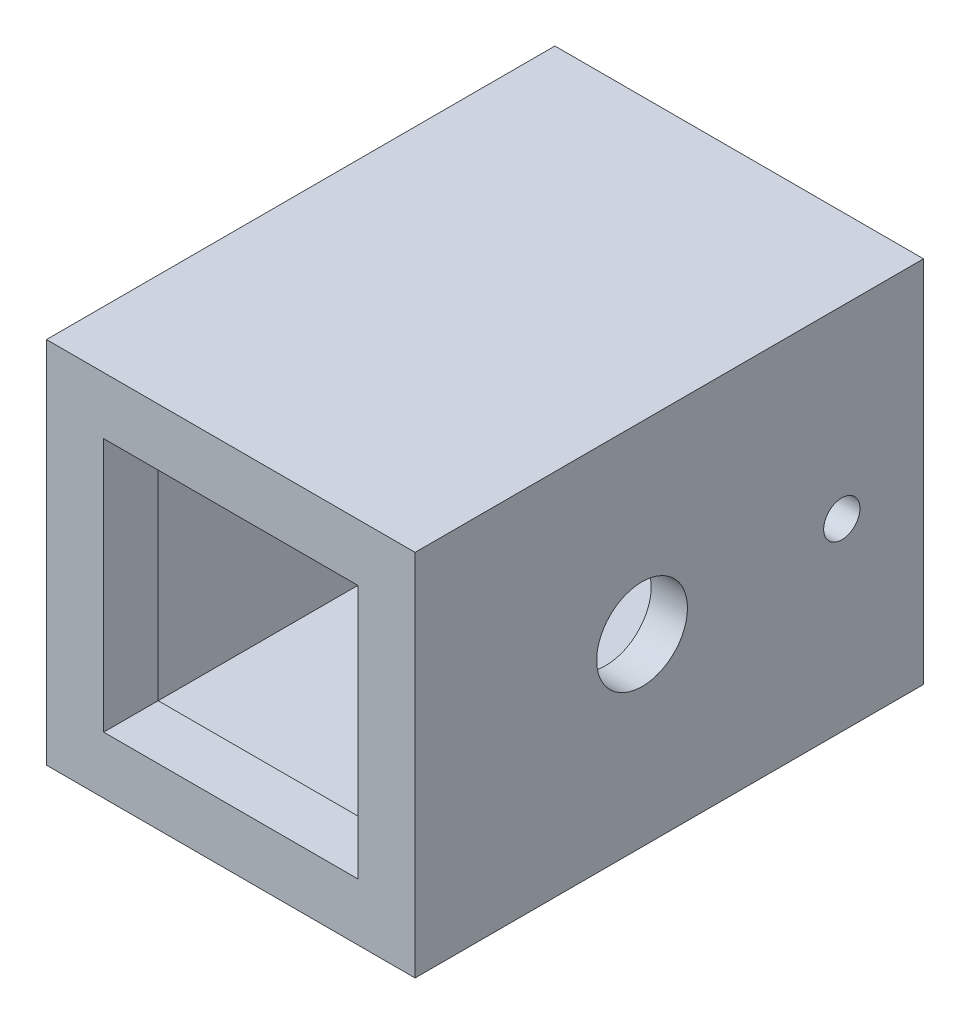
from build123d import *

# Parameters (mm, degrees)
SKETCH1_W           = 20.3
SKETCH1_H           = 20.3
SKETCH1_W_2         = 16.3
SKETCH1_H_2         = 16.3
BOSS_EXTRUDE1_DEPTH = 25
SKETCH2_W           = 20.3
SKETCH2_H           = 20.3
SKETCH2_W_2         = 14
SKETCH2_H_2         = 14
BOSS_EXTRUDE2_DEPTH = 3
SKETCH3_R           = 1
SKETCH3_R_2         = 2.5
CUT_EXTRUDE1_DEPTH  = 34.765551972
FILLET1_R           = 1


with BuildPart() as part:
    # Sketch1 → Boss-Extrude1 (new body)
    with BuildSketch(Plane.XY):
        Rectangle(SKETCH1_W, SKETCH1_H)
        Rectangle(SKETCH1_W_2, SKETCH1_H_2, mode=Mode.SUBTRACT)
    extrude(amount=-BOSS_EXTRUDE1_DEPTH)

    # Sketch2 → Boss-Extrude2 (add)
    with BuildSketch(Plane.XY):
        Rectangle(SKETCH2_W, SKETCH2_H)
        Rectangle(SKETCH2_W_2, SKETCH2_H_2, mode=Mode.SUBTRACT)
    extrude(amount=BOSS_EXTRUDE2_DEPTH)

    # Sketch3 → Cut-Extrude1 (cut, through all)
    with BuildSketch(Plane(origin=(10.15, 0, 0), x_dir=(0, 0, -1), z_dir=(1, 0, 0))):
        with Locations((20.5, 0)):
            Circle(SKETCH3_R)
        with Locations((9.5, 0)):
            Circle(SKETCH3_R_2)
    extrude(amount=-CUT_EXTRUDE1_DEPTH, mode=Mode.SUBTRACT)

    # Fillet1
    fillet1_edges = [part.edges().sort_by_distance(p)[0] for p in [
        (-8.15, 0, -25),
        (0, -8.15, -25),
        (8.15, 0, -25),
        (0, 8.15, -25),
    ]]
    fillet(fillet1_edges, radius=FILLET1_R)


solid = part.part
